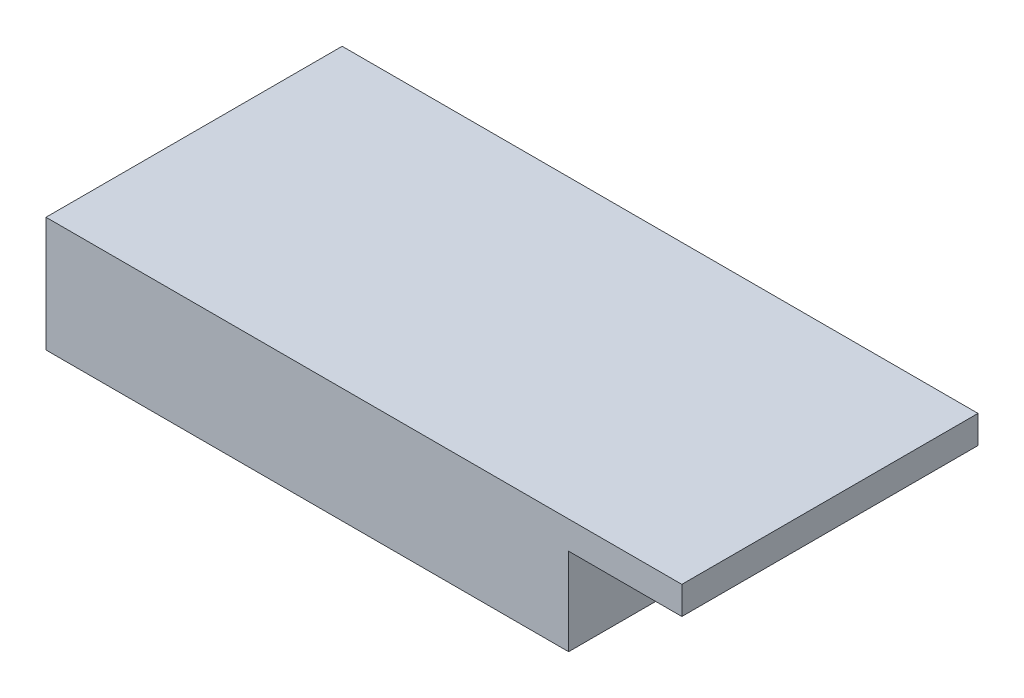
from build123d import *

# Parameters (mm, degrees)
SKETCH1_W           = 30
SKETCH1_H           = 17
BOSS_EXTRUDE1_DEPTH = 6.6
SKETCH2_W           = 6.5
SKETCH2_H           = 17
BOSS_EXTRUDE2_DEPTH = 1.6


with BuildPart() as part:
    # Sketch1 → Boss-Extrude1 (new body)
    with BuildSketch(Plane(origin=(0, 0, 0), x_dir=(1, 0, 0), z_dir=(0, 1, 0))):
        with Locations((15, 8.5)):
            Rectangle(SKETCH1_W, SKETCH1_H)
    extrude(amount=BOSS_EXTRUDE1_DEPTH)

    # Sketch2 → Boss-Extrude2 (add)
    with BuildSketch(Plane(origin=(0, 6.6, 0), x_dir=(1, 0, 0), z_dir=(0, 1, 0))):
        with Locations((33.25, 8.5)):
            Rectangle(SKETCH2_W, SKETCH2_H)
    extrude(amount=-BOSS_EXTRUDE2_DEPTH)


solid = part.part
